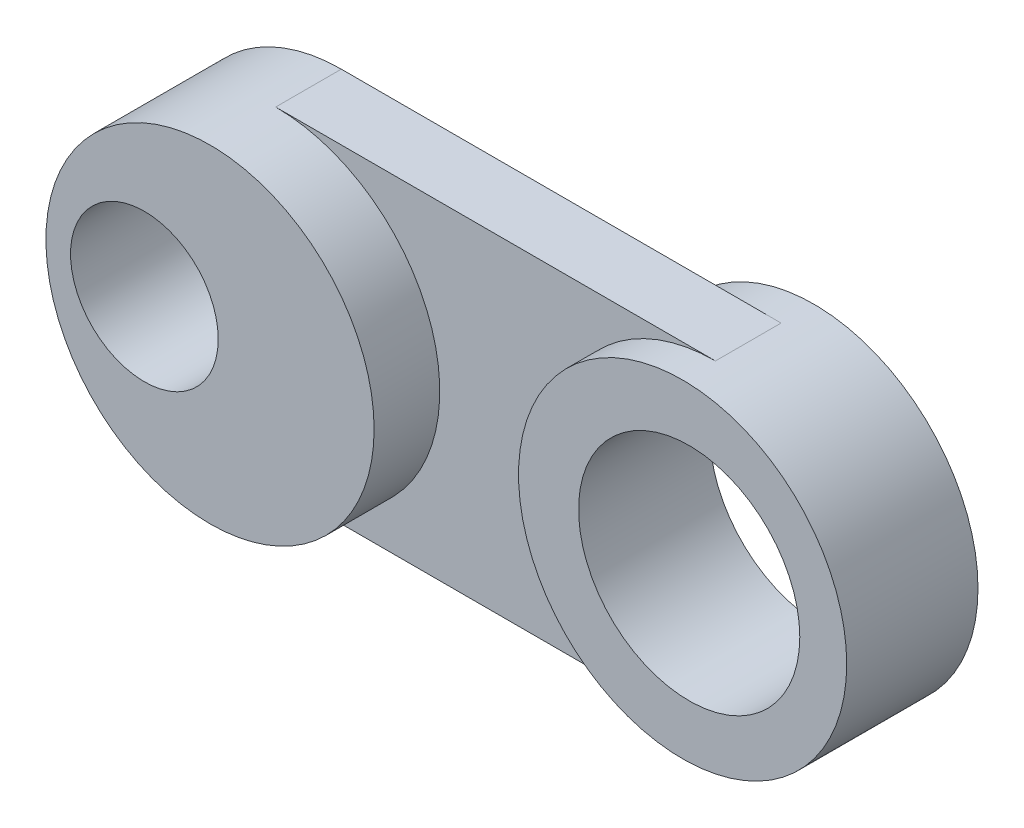
from build123d import *
from build123d.topology import SkipClean

# Parameters (mm, degrees)
SKETCH1_R           = 2.8575
SKETCH1_R_2         = 4.2799
BOSS_EXTRUDE1_DEPTH = 1.27
BOSS_EXTRUDE2_START = 2.54
SKETCH2_R           = 2.8575
BOSS_EXTRUDE2_DEPTH = 2.54
SKETCH4_R           = 6.35
SKETCH4_R_2         = 4.2799
BOSS_EXTRUDE4_DEPTH = 2.54


with BuildPart() as part:
    # Sketch1 → Boss-Extrude1 (new, symmetric)
    with BuildSketch(Plane.XY):
        with BuildLine():
            Line((0, 12.7), (17.018, 12.7))
            ThreePointArc((17.018, 12.7), (23.368, 6.35), (17.018, 0))
            Line((17.018, 0), (0, 0))
            ThreePointArc((0, 0), (-6.35, 6.35), (0, 12.7))
        make_face()
        with Locations((-2.54, 6.35)):
            Circle(SKETCH1_R, mode=Mode.SUBTRACT)
        with Locations((17.272, 6.35)):
            Circle(SKETCH1_R_2, mode=Mode.SUBTRACT)
    extrude(amount=BOSS_EXTRUDE1_DEPTH, both=True)

    # Sketch2 → Boss-Extrude2 (add)
    with SkipClean():  # the faces are left unmerged after this step: merging them gives an invalid solid
        with BuildSketch(Plane.XY.offset(1.27).offset(BOSS_EXTRUDE2_START)):
            with BuildLine():
                ThreePointArc((0, 0), (4.490128061, 1.859871939), (6.35, 6.35))
                ThreePointArc((6.35, 6.35), (4.490128061, 10.840128061), (0, 12.7))
                ThreePointArc((0, 12.7), (-6.35, 6.35), (0, 0))
            make_face()
            with Locations((-2.54, 6.35)):
                Circle(SKETCH2_R, mode=Mode.SUBTRACT)
        extrude(amount=-BOSS_EXTRUDE2_DEPTH)

    # Sketch4 → Boss-Extrude4 (add, symmetric)
    with SkipClean():  # the faces are left unmerged after this step: merging them gives an invalid solid
        with BuildSketch(Plane.XY):
            with Locations((17.018, 6.35)):
                Circle(SKETCH4_R)
            with Locations((17.272, 6.35)):
                Circle(SKETCH4_R_2, mode=Mode.SUBTRACT)
        extrude(amount=BOSS_EXTRUDE4_DEPTH, both=True)


solid = part.part
